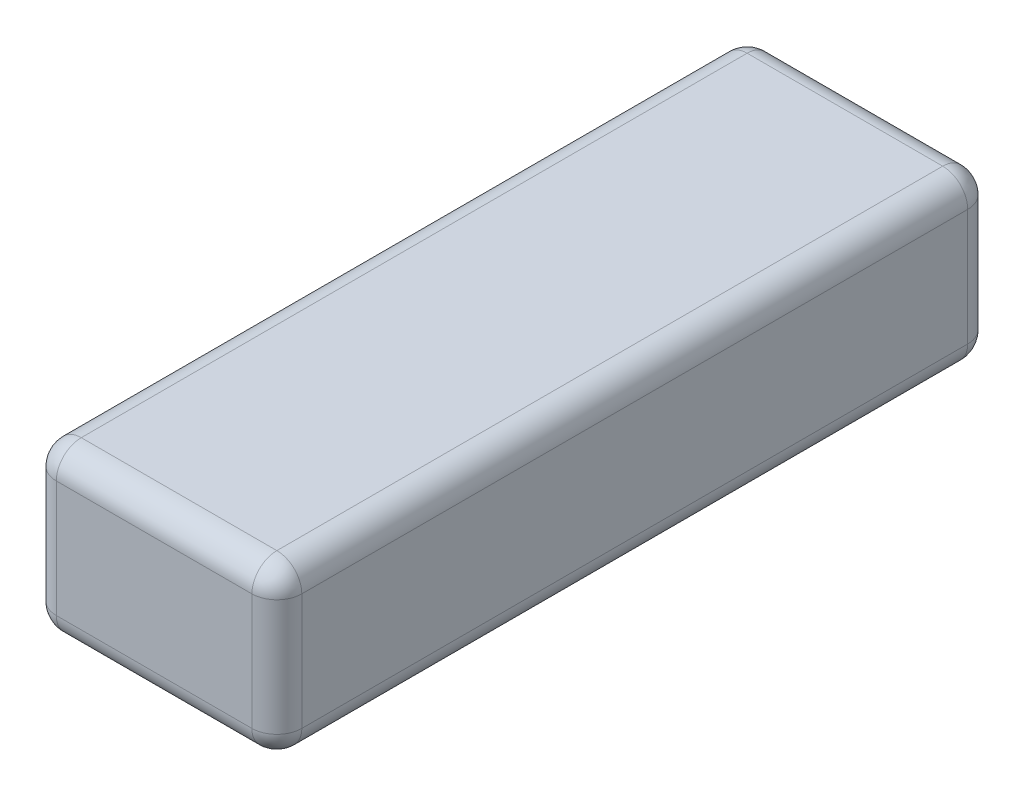
from build123d import *

# Parameters (mm, degrees)
SKETCH1_W           = 29.5
SKETCH1_H           = 86
BOSS_EXTRUDE1_DEPTH = 10
FILLET1_R           = 3


with BuildPart() as part:
    # Sketch1 → Boss-Extrude1 (new, symmetric)
    with BuildSketch(Plane(origin=(0, 0, 0), x_dir=(1, 0, 0), z_dir=(0, 1, 0))):
        Rectangle(SKETCH1_W, SKETCH1_H)
    extrude(amount=BOSS_EXTRUDE1_DEPTH, both=True)

    # Fillet1
    fillet1_edges = [part.edges().sort_by_distance(p)[0] for p in [
        (-14.75, 10, 0),
        (0, 10, 43),
        (14.75, 10, 0),
        (0, -10, 43),
        (-14.75, -10, 0),
        (0, -10, -43),
        (14.75, -10, 0),
        (14.75, 0, 43),
        (-14.75, 0, 43),
        (-14.75, 0, -43),
        (14.75, 0, -43),
        (0, 10, -43),
    ]]
    fillet(fillet1_edges, radius=FILLET1_R)


solid = part.part
